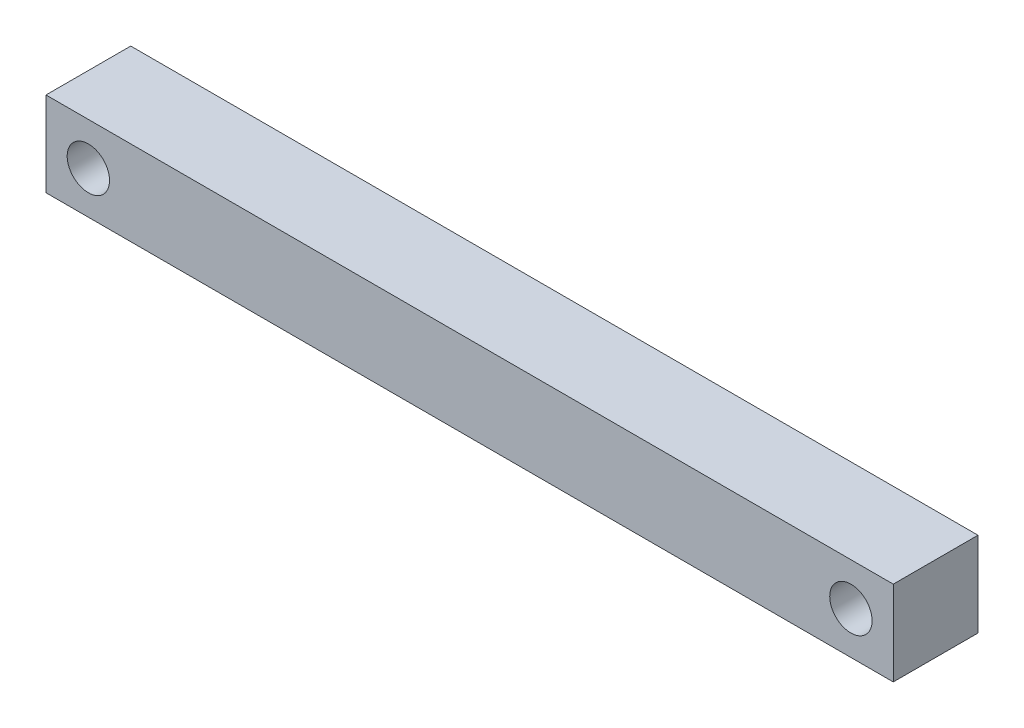
from build123d import *

# Parameters (mm, degrees)
SKETCH1_W           = 200
SKETCH1_H           = 20
BOSS_EXTRUDE2_DEPTH = 20
SKETCH3_R           = 5
CUT_EXTRUDE1_DEPTH  = 103.46950766


with BuildPart() as part:
    # Sketch1 → Boss-Extrude2 (new body)
    with BuildSketch(Plane.XY):
        Rectangle(SKETCH1_W, SKETCH1_H)
    extrude(amount=BOSS_EXTRUDE2_DEPTH)

    # Sketch3 → Cut-Extrude1 (cut, through all)
    with BuildSketch(Plane.XY.offset(20)):
        with Locations((-90, 0)):
            Circle(SKETCH3_R)
    cut_extrude1 = extrude(amount=-CUT_EXTRUDE1_DEPTH, mode=Mode.SUBTRACT)

    # Mirror1: Cut-Extrude1 across plane
    add(cut_extrude1.mirror(Plane(origin=(0, 0, 0), x_dir=(0, 0, 1), z_dir=(1, 0, 0))), mode=Mode.SUBTRACT)


solid = part.part
